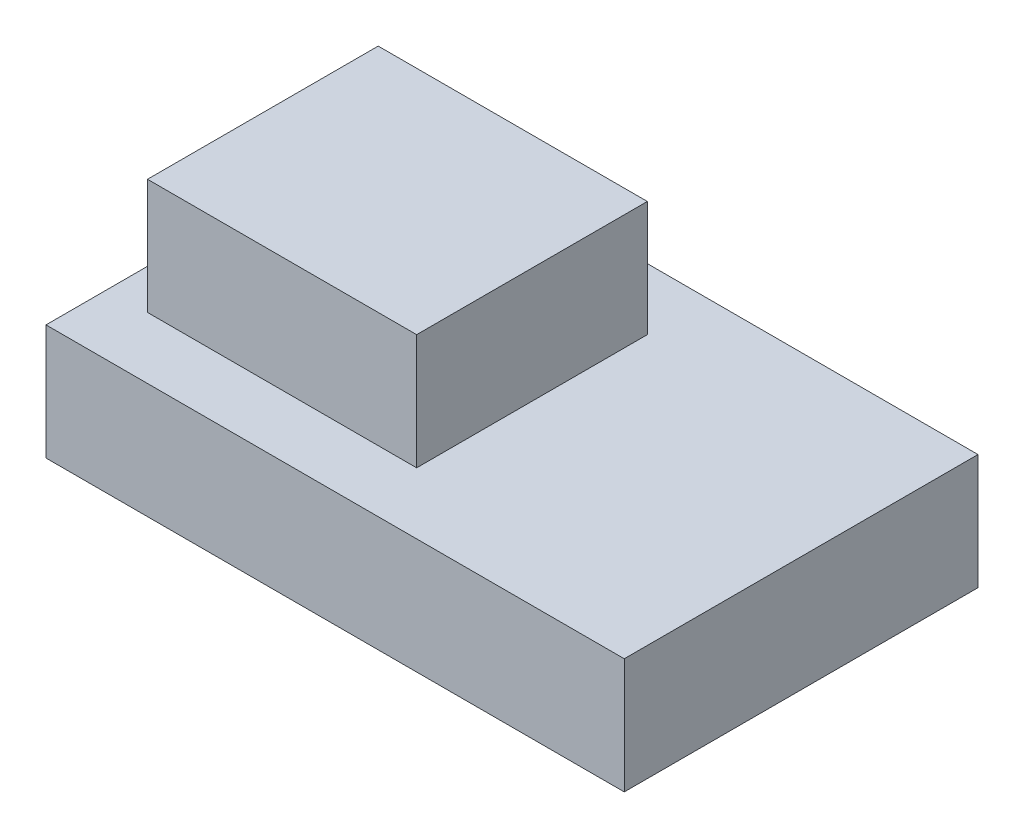
from build123d import *

# Parameters (mm, degrees)
SKETCH1_W           = 95.504
SKETCH1_H           = 58.42
BOSS_EXTRUDE1_DEPTH = 19.05
SKETCH2_W           = 44.45
SKETCH2_H           = 38.1
BOSS_EXTRUDE2_DEPTH = 19.05


with BuildPart() as part:
    # Sketch1 → Boss-Extrude1 (new body)
    with BuildSketch(Plane(origin=(0, 0, 0), x_dir=(1, 0, 0), z_dir=(0, 1, 0))):
        Rectangle(SKETCH1_W, SKETCH1_H)
    extrude(amount=BOSS_EXTRUDE1_DEPTH)

    # Sketch2 → Boss-Extrude2 (add)
    with BuildSketch(Plane(origin=(0, 19.05, 0), x_dir=(1, 0, 0), z_dir=(0, 1, 0))):
        with Locations((-18.923, 0)):
            Rectangle(SKETCH2_W, SKETCH2_H)
    extrude(amount=BOSS_EXTRUDE2_DEPTH)


solid = part.part
